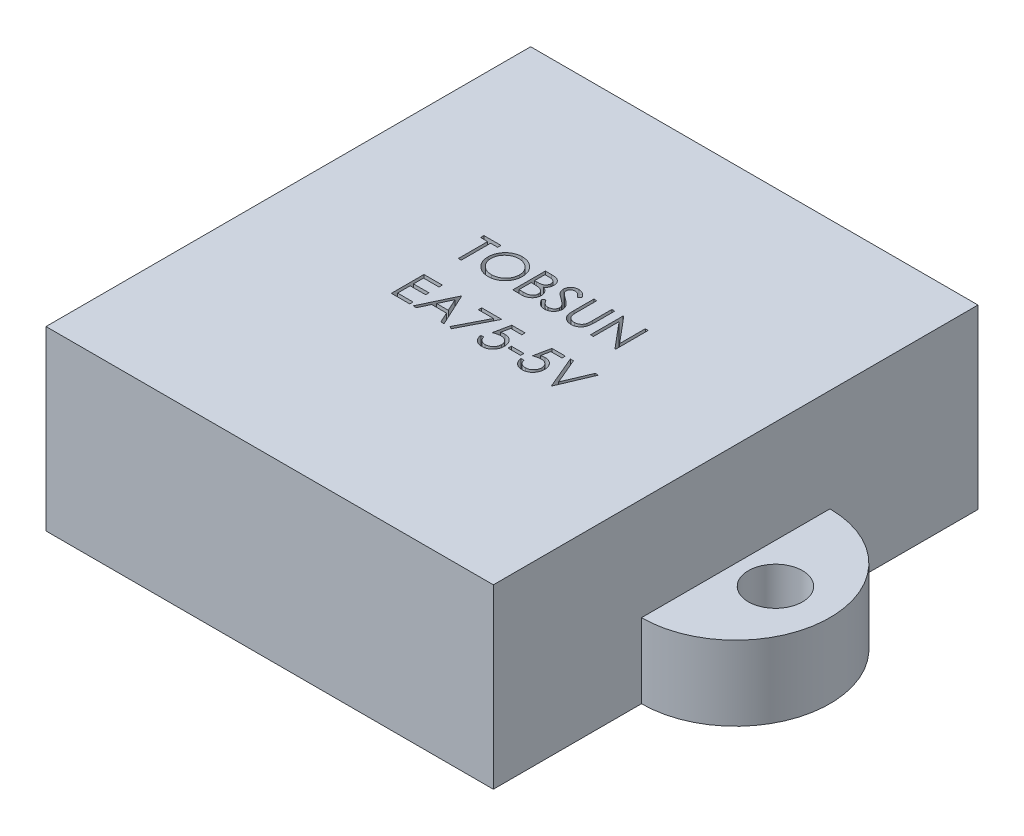
from build123d import *

# Parameters (mm, degrees)
BOSS_EXTRUDE1_DEPTH = 19
SKETCH1_3_R         = 2.903793018
BOSS_EXTRUDE2_DEPTH = 8
SKETCH2_W           = 1.346153847
SKETCH2_H           = 0.358974359
CUT_EXTRUDE1_DEPTH  = 5.08


with BuildPart() as part:
    # Sketch1 → Boss-Extrude1 (new body)
    with BuildSketch(Plane(origin=(0, 0, 0), x_dir=(1, 0, 0), z_dir=(0, 1, 0))):
        Polygon((-24, -10.110797376), (-24, -26), (24, -26), (24, -10.110797376), (24, 10.110797376), (24, 26), (-24, 26), (-24, 10.110797376), align=None)
    extrude(amount=BOSS_EXTRUDE1_DEPTH)

    # Sketch1<3> → Boss-Extrude2 (add)
    # profile 1 of 2: a face of its own
    with BuildSketch(Plane(origin=(0, 0, 0), x_dir=(1, 0, 0), z_dir=(0, 1, 0))):
        with BuildLine():
            ThreePointArc((-24, 10.110797376), (-34.110797376, 0), (-24, -10.110797376))
            Line((-24, -10.110797376), (-24, 10.110797376))
        make_face()
        with Locations((-28.268250103, 0)):
            Circle(SKETCH1_3_R, mode=Mode.SUBTRACT)
    # profile 2 of 2: a face of its own
    with BuildSketch(Plane(origin=(0, 0, 0), x_dir=(1, 0, 0), z_dir=(0, 1, 0))):
        with BuildLine():
            Line((24, 10.110797376), (24, -10.110797376))
            ThreePointArc((24, -10.110797376), (34.110797376, 0), (24, 10.110797376))
        make_face()
        with Locations((28.268250103, 0)):
            Circle(SKETCH1_3_R, mode=Mode.SUBTRACT)
    extrude(amount=BOSS_EXTRUDE2_DEPTH)

    # Sketch2 → Cut-Extrude1 (cut)
    # profile 1 of 13: a face of its own
    with BuildSketch(Plane(origin=(0, 19, 0), x_dir=(1, 0, 0), z_dir=(0, 1, 0))):
        Polygon((-8.963909343, 5.588292958), (-8.963909343, 5.947267317), (-7.124165753, 5.947267317), (-7.124165753, 5.588292958), (-7.886986266, 5.588292958), (-7.886986266, 2.447267317), (-8.20108883, 2.447267317), (-8.20108883, 5.588292958), align=None)
    # profile 2 of 13: a face of its own
    with BuildSketch(Plane(origin=(0, 19, 0), x_dir=(1, 0, 0), z_dir=(0, 1, 0))):
        with BuildLine():
            add(Edge.make_bspline(
                [(-4.947883702, 6.037010907), (-4.883075596, 6.035369427), (-4.755787129, 6.032145426), (-4.568712231, 6.007466323), (-4.390117136, 5.964770933), (-4.218546997, 5.90790795), (-4.056054021, 5.832053565), (-3.901415128, 5.740368417), (-3.754998254, 5.631891958), (-3.618776873, 5.507462731), (-3.494119923, 5.372079277), (-3.384294036, 5.227601367), (-3.292251743, 5.074902565), (-3.216665955, 4.914441734), (-3.157367346, 4.746581766), (-3.116448302, 4.570427763), (-3.090310152, 4.387121073), (-3.087254374, 4.262094209), (-3.085704215, 4.198669561)],
                knots=[0, 0, 0, 0, 1.065120563, 2.091984664, 3.0946048, 4.079830382, 5.057816894, 6.036188127, 7.030412546, 8.04752943, 9.064399622, 10.05169764, 11.02544977, 11.989514704, 12.962713494, 13.945757189, 14.957906945, 16, 16, 16, 16], degree=3))
            add(Edge.make_bspline(
                [(-3.085704215, 4.198669561), (-3.087254147, 4.135712114), (-3.090309244, 4.011615694), (-3.116478021, 3.82947225), (-3.157519021, 3.654381553), (-3.216115288, 3.4866359), (-3.291340766, 3.326058337), (-3.383995937, 3.173071383), (-3.493137148, 3.027624884), (-3.617343999, 2.891312219), (-3.752745041, 2.766314748), (-3.897975308, 2.657395873), (-4.049768628, 2.563671748), (-4.210078336, 2.488888074), (-4.376778373, 2.429116154), (-4.551360696, 2.388363524), (-4.73300725, 2.36207648), (-4.856878254, 2.359057964), (-4.91983883, 2.357523727)],
                knots=[0, 0, 0, 0, 1.043624062, 2.057103931, 3.04512605, 4.022047818, 4.998200453, 5.980619268, 6.982898556, 8.009068085, 9.034988726, 10.034168286, 11.015286542, 11.987931943, 12.962482838, 13.94673481, 14.956375938, 16, 16, 16, 16], degree=3))
            add(Edge.make_bspline(
                [(-4.91983883, 2.357523727), (-4.983263149, 2.359073114), (-5.108289365, 2.362127368), (-5.2918264, 2.388308773), (-5.468104144, 2.429250077), (-5.636618496, 2.487759513), (-5.797463425, 2.563376744), (-5.950953508, 2.655581123), (-6.096472655, 2.764988264), (-6.232814402, 2.889154838), (-6.3575636, 3.02432639), (-6.466322975, 3.169160645), (-6.558548089, 3.320816102), (-6.633911421, 3.479713626), (-6.693575881, 3.645085069), (-6.734280699, 3.818033546), (-6.760616651, 3.997573052), (-6.763651497, 4.119815951), (-6.765191394, 4.181842637)],
                knots=[0, 0, 0, 0, 1.053102029, 2.075944431, 3.073151272, 4.055350789, 5.033113405, 6.020478099, 7.024410459, 8.052272461, 9.079885166, 10.07527673, 11.055994387, 12.023226415, 12.992069828, 13.970394897, 14.97016774, 16, 16, 16, 16], degree=3))
            add(Edge.make_bspline(
                [(-6.765191394, 4.181842637), (-6.764656759, 4.223475307), (-6.763594232, 4.30621543), (-6.75080254, 4.42908203), (-6.732240839, 4.549972688), (-6.705638926, 4.668543636), (-6.670847259, 4.784504621), (-6.629795232, 4.898655384), (-6.579655386, 5.009839107), (-6.522974738, 5.118582499), (-6.45971293, 5.223190405), (-6.389837181, 5.322069988), (-6.315801812, 5.416050985), (-6.234638419, 5.502697989), (-6.149021974, 5.584531645), (-6.057563596, 5.660294362), (-5.960821351, 5.730669313), (-5.858378971, 5.794089654), (-5.752760697, 5.851448789), (-5.643883919, 5.90067064), (-5.533227347, 5.942916701), (-5.420272699, 5.977157526), (-5.305319927, 6.004189562), (-5.188118143, 6.022596916), (-5.068760716, 6.035421234), (-4.988349397, 6.036478736), (-4.947883702, 6.037010907)],
                knots=[0, 0, 0, 0, 1.037015668, 2.060948919, 3.074880161, 4.083647147, 5.086022904, 6.090072063, 7.104153813, 8.122640571, 9.144368836, 10.147691507, 11.138137339, 12.123020368, 13.103399296, 14.087645067, 15.080126199, 16.082011238, 17.087798457, 18.072939717, 19.057185487, 20.037253025, 21.01195951, 21.997135196, 22.992090687, 24, 24, 24, 24], degree=3))
        make_face()
        with BuildLine():
            add(Edge.make_bspline(
                [(-4.932459022, 5.678036548), (-4.965673656, 5.677631657), (-5.031785389, 5.676825748), (-5.130069925, 5.666210032), (-5.227061859, 5.651080143), (-5.322781221, 5.629498622), (-5.416827511, 5.60009457), (-5.510077352, 5.566253661), (-5.601680406, 5.525032571), (-5.691334263, 5.478459867), (-5.778249339, 5.426910946), (-5.86026204, 5.369939179), (-5.937584684, 5.308880624), (-6.010027951, 5.243592787), (-6.077379123, 5.173743185), (-6.140963824, 5.100390749), (-6.198233406, 5.021438858), (-6.250718983, 4.939028451), (-6.297686823, 4.85326687), (-6.339452178, 4.765057008), (-6.373616187, 4.673679321), (-6.401478563, 4.580125163), (-6.424578374, 4.484542704), (-6.439212298, 4.386206855), (-6.449944657, 4.285611743), (-6.450704503, 4.217629889), (-6.45108883, 4.183244881)],
                knots=[0, 0, 0, 0, 1.008559885, 2.007477868, 2.99961109, 3.989939068, 4.984837346, 5.991145699, 7.001802488, 8.033829008, 9.059044045, 10.069351652, 11.065060232, 12.050310815, 13.029377138, 14.011219647, 14.996725999, 15.989392538, 16.977580475, 17.965360261, 18.951710183, 19.937753436, 20.929683414, 21.935841486, 22.955955122, 24, 24, 24, 24], degree=3))
            add(Edge.make_bspline(
                [(-6.45108883, 4.183244881), (-6.449813968, 4.13268266), (-6.44730592, 4.03321113), (-6.42534835, 3.887442986), (-6.391526376, 3.7473547), (-6.341669009, 3.61371279), (-6.279318395, 3.485368508), (-6.202291504, 3.363460403), (-6.111032419, 3.247955529), (-6.007368892, 3.13966026), (-5.894046186, 3.040814455), (-5.773713456, 2.954051047), (-5.647659848, 2.880640797), (-5.515556646, 2.820835725), (-5.378109106, 2.773445987), (-5.234431555, 2.740967356), (-5.085481096, 2.7195919), (-4.983950441, 2.717539144), (-4.932459022, 2.716498086)],
                knots=[0, 0, 0, 0, 1.032063989, 2.030389145, 3.003944642, 3.970395727, 4.937377036, 5.913328081, 6.909231446, 7.93887556, 8.970685674, 9.976071282, 10.964166581, 11.944589148, 12.933237628, 13.927779006, 14.949070134, 16, 16, 16, 16], degree=3))
            add(Edge.make_bspline(
                [(-4.932459022, 2.716498086), (-4.897849521, 2.716973591), (-4.829208484, 2.717916659), (-4.727112962, 2.727415335), (-4.62685675, 2.742647205), (-4.528580471, 2.76457786), (-4.432395659, 2.792025067), (-4.337900856, 2.824632795), (-4.246102566, 2.865313998), (-4.155842728, 2.91026195), (-4.069446486, 2.961502108), (-3.986970954, 3.016540257), (-3.910494974, 3.077508878), (-3.838105903, 3.141826691), (-3.770478214, 3.210790538), (-3.708069229, 3.28431076), (-3.651089097, 3.362851417), (-3.598623451, 3.445136823), (-3.551820188, 3.531133076), (-3.511041089, 3.619662754), (-3.476444973, 3.710507863), (-3.448516468, 3.803799435), (-3.426631007, 3.899360283), (-3.411551087, 3.997318362), (-3.401002648, 4.097477704), (-3.400207571, 4.16522156), (-3.399806779, 4.199370682)],
                knots=[0, 0, 0, 0, 1.047197238, 2.076906641, 3.100256066, 4.114471768, 5.12198147, 6.126382909, 7.136867548, 8.15857795, 9.17633901, 10.174870724, 11.156907918, 12.133735059, 13.104061851, 14.077631395, 15.04955518, 16.038496417, 17.029181396, 18.010275684, 18.986308667, 19.968651475, 20.955262928, 21.950658345, 22.966943676, 24, 24, 24, 24], degree=3))
            add(Edge.make_bspline(
                [(-3.399806779, 4.199370682), (-3.400207892, 4.233286187), (-3.401003573, 4.300563837), (-3.411546048, 4.400024655), (-3.426646938, 4.497277867), (-3.448409646, 4.59194167), (-3.4764598, 4.684040195), (-3.511047131, 4.773486942), (-3.55183243, 4.860615137), (-3.598640654, 4.945209434), (-3.651256478, 5.026384172), (-3.708750721, 5.103986585), (-3.772116069, 5.176559326), (-3.839542094, 5.24589402), (-3.912712979, 5.31051191), (-3.991297274, 5.370434431), (-4.074340951, 5.427107705), (-4.162268187, 5.478233267), (-4.253012141, 5.525447499), (-4.346126098, 5.565898503), (-4.440555198, 5.600270622), (-4.53605931, 5.629587587), (-4.633442289, 5.650995617), (-4.732046118, 5.666223667), (-4.831734376, 5.676822053), (-4.898777596, 5.677630431), (-4.932459022, 5.678036548)],
                knots=[0, 0, 0, 0, 1.02996197, 2.043119294, 3.035359645, 4.018872909, 4.991431989, 5.957985074, 6.929999688, 7.912076566, 8.892894881, 9.867085534, 10.843653904, 11.817741046, 12.803660682, 13.806313499, 14.818574707, 15.856120519, 16.894564902, 17.924820532, 18.937903209, 19.946497019, 20.957711757, 21.963978472, 22.977135795, 24, 24, 24, 24], degree=3))
        make_face(mode=Mode.SUBTRACT)
    # profile 3 of 13: a face of its own
    with BuildSketch(Plane(origin=(0, 19, 0), x_dir=(1, 0, 0), z_dir=(0, 1, 0))):
        with BuildLine():
            Line((-2.367755497, 5.947267317), (-1.684862869, 5.947267317))
            add(Edge.make_bspline(
                [(-1.684862869, 5.947267317), (-1.65143439, 5.947091567), (-1.58664168, 5.946750919), (-1.492422238, 5.941467787), (-1.404173428, 5.934264118), (-1.321869655, 5.922834025), (-1.245548953, 5.909042248), (-1.174981316, 5.892340432), (-1.110391143, 5.872313818), (-1.033278407, 5.840467537), (-0.945357746, 5.793144368), (-0.850159353, 5.723215803), (-0.768755114, 5.63768334), (-0.698568797, 5.541200685), (-0.642767677, 5.435064913), (-0.60239838, 5.321805724), (-0.576840505, 5.202883982), (-0.57421207, 5.121240804), (-0.572883702, 5.079979657)],
                knots=[0, 0, 0, 0, 1.001505555, 1.941167018, 2.826882275, 3.653841531, 4.429895133, 5.150066043, 5.825578002, 6.45369114, 7.647487171, 8.808567382, 9.977351308, 11.170798116, 12.373658725, 13.556498008, 14.765093433, 16, 16, 16, 16], degree=3))
            add(Edge.make_bspline(
                [(-0.572883702, 5.079979657), (-0.57397692, 5.041327101), (-0.576125198, 4.965371184), (-0.596667957, 4.854277075), (-0.628828626, 4.748525856), (-0.673533875, 4.64850347), (-0.731635871, 4.556469857), (-0.80049419, 4.471682591), (-0.883570992, 4.397731534), (-0.945814232, 4.356388632), (-0.977430978, 4.335388311)],
                knots=[0, 0, 0, 0, 1.044552857, 2.05264487, 3.044412934, 4.028983338, 5.005914585, 5.980388656, 6.974128949, 8, 8, 8, 8], degree=3))
            add(Edge.make_bspline(
                [(-0.977430978, 4.335388311), (-0.93767055, 4.320123312), (-0.861599003, 4.290917587), (-0.75691299, 4.239282123), (-0.666718145, 4.183120013), (-0.590320999, 4.121788163), (-0.524983344, 4.055679352), (-0.467930403, 3.983824238), (-0.419249029, 3.90528548), (-0.377536105, 3.820881944), (-0.344987349, 3.731475476), (-0.320611445, 3.6379047), (-0.306643995, 3.540505145), (-0.304656354, 3.474219765), (-0.303652933, 3.4407569)],
                knots=[0, 0, 0, 0, 1.27268992, 2.434971085, 3.483601985, 4.442670788, 5.356604649, 6.2567628, 7.179492994, 8.113709626, 9.066344395, 10.018646069, 10.999752585, 12, 12, 12, 12], degree=3))
            add(Edge.make_bspline(
                [(-0.303652933, 3.4407569), (-0.304629779, 3.406590028), (-0.306551751, 3.33936575), (-0.320731722, 3.240610616), (-0.344740829, 3.146235669), (-0.377811976, 3.055630486), (-0.42097429, 2.968970352), (-0.473502255, 2.886157088), (-0.536133818, 2.808022757), (-0.606196687, 2.733699134), (-0.685458833, 2.666871347), (-0.770974588, 2.60735564), (-0.863820908, 2.558409578), (-0.962472902, 2.517293556), (-1.068037218, 2.485886358), (-1.180039825, 2.463913784), (-1.298384127, 2.449108747), (-1.379593878, 2.447891542), (-1.421241074, 2.447267317)],
                knots=[0, 0, 0, 0, 0.978564426, 1.925352924, 2.850884081, 3.763762016, 4.682927383, 5.618979971, 6.567305752, 7.547517671, 8.540179244, 9.531824382, 10.526200242, 11.540722885, 12.589160233, 13.674978461, 14.80764778, 16, 16, 16, 16], degree=3))
            Line((-1.421241074, 2.447267317), (-2.367755497, 2.447267317))
            Line((-2.367755497, 2.447267317), (-2.367755497, 5.947267317))
        make_face()
        with BuildLine():
            Line((-2.053652933, 5.588292958), (-2.053652933, 4.466498086))
            Line((-2.053652933, 4.466498086), (-1.842615272, 4.466498086))
            add(Edge.make_bspline(
                [(-1.842615272, 4.466498086), (-1.811766477, 4.466898009), (-1.752160318, 4.467670742), (-1.665840421, 4.469884259), (-1.585715403, 4.476082302), (-1.51192357, 4.482278564), (-1.444581126, 4.492353152), (-1.383837265, 4.504345275), (-1.328738668, 4.51702818), (-1.265199122, 4.538597667), (-1.193126174, 4.570475342), (-1.116293069, 4.619947178), (-1.0485586, 4.678871532), (-0.991361412, 4.746862493), (-0.944549942, 4.821728679), (-0.912036226, 4.90227556), (-0.889988942, 4.986495692), (-0.887997411, 5.044313944), (-0.886986266, 5.073669561)],
                knots=[0, 0, 0, 0, 1.156816544, 2.235205308, 3.236616184, 4.169592532, 5.011045266, 5.787822928, 6.49130361, 7.128639758, 8.301311294, 9.436451833, 10.541879658, 11.654887649, 12.756523258, 13.837046038, 14.901820046, 16, 16, 16, 16], degree=3))
            add(Edge.make_bspline(
                [(-0.886986266, 5.073669561), (-0.887512446, 5.093095332), (-0.888544606, 5.131201104), (-0.896997909, 5.186750458), (-0.911365483, 5.238994211), (-0.929819776, 5.288648321), (-0.955608465, 5.334160171), (-0.985971928, 5.377103367), (-1.022657619, 5.416015486), (-1.064414931, 5.452384984), (-1.112423554, 5.484629512), (-1.166654846, 5.512870275), (-1.227842523, 5.535611052), (-1.294955378, 5.555527204), (-1.369026466, 5.569515498), (-1.449201019, 5.581168886), (-1.536135738, 5.587101628), (-1.596280841, 5.58788699), (-1.627370881, 5.588292958)],
                knots=[0, 0, 0, 0, 0.91205012, 1.789085906, 2.630437955, 3.453916878, 4.269457761, 5.079663411, 5.91843418, 6.774407191, 7.675494373, 8.627863946, 9.638891023, 10.736472738, 11.911756761, 13.175263542, 14.539845004, 16, 16, 16, 16], degree=3))
            Line((-1.627370881, 5.588292958), (-2.053652933, 5.588292958))
        make_face(mode=Mode.SUBTRACT)
        with BuildLine():
            Line((-2.053652933, 4.107523727), (-2.053652933, 2.806241676))
            Line((-2.053652933, 2.806241676), (-1.606337228, 2.806241676))
            add(Edge.make_bspline(
                [(-1.606337228, 2.806241676), (-1.574318302, 2.806625423), (-1.512606043, 2.807365046), (-1.423504813, 2.8097796), (-1.340921709, 2.815271876), (-1.265233573, 2.823917726), (-1.195623121, 2.833296175), (-1.132925418, 2.845907456), (-1.076632224, 2.860356416), (-1.011357917, 2.882690589), (-0.937854408, 2.91738706), (-0.858643552, 2.969701286), (-0.788217334, 3.032024594), (-0.728412075, 3.104155508), (-0.679399086, 3.182586835), (-0.643743631, 3.265732185), (-0.621752774, 3.352217712), (-0.619090605, 3.411184425), (-0.617755497, 3.4407569)],
                knots=[0, 0, 0, 0, 1.160039823, 2.235823828, 3.228722157, 4.157150951, 4.99529583, 5.772374946, 6.472645482, 7.099169577, 8.269452708, 9.405989375, 10.527446681, 11.663510218, 12.788923519, 13.866172445, 14.929861265, 16, 16, 16, 16], degree=3))
            add(Edge.make_bspline(
                [(-0.617755497, 3.4407569), (-0.618031601, 3.459250241), (-0.618579356, 3.495938623), (-0.626839971, 3.549854442), (-0.638853841, 3.602080315), (-0.654385275, 3.652758056), (-0.677004742, 3.700971432), (-0.703411287, 3.747673991), (-0.734372689, 3.792927471), (-0.782616854, 3.850139724), (-0.852788839, 3.916056737), (-0.952495614, 3.98059424), (-1.065867912, 4.032642047), (-1.148095405, 4.054741523), (-1.190572003, 4.066157541)],
                knots=[0, 0, 0, 0, 0.723448775, 1.435228256, 2.130040452, 2.821711965, 3.505591119, 4.210454504, 4.921174351, 5.648778258, 7.137944449, 8.670945889, 10.280296675, 12, 12, 12, 12], degree=3))
            add(Edge.make_bspline(
                [(-1.190572003, 4.066157541), (-1.207601099, 4.069612625), (-1.244523691, 4.07710396), (-1.304731272, 4.085011663), (-1.373467141, 4.092056723), (-1.450890018, 4.097267881), (-1.537097859, 4.102654424), (-1.632274778, 4.104749246), (-1.736032092, 4.107248506), (-1.808024465, 4.10742964), (-1.84541976, 4.107523727)],
                knots=[0, 0, 0, 0, 0.634451884, 1.375622551, 2.216452059, 3.157844607, 4.20941857, 5.370758133, 6.634282058, 8, 8, 8, 8], degree=3))
            Line((-1.84541976, 4.107523727), (-2.053652933, 4.107523727))
        make_face(mode=Mode.SUBTRACT)
    # profile 4 of 13: a face of its own
    with BuildSketch(Plane(origin=(0, 19, 0), x_dir=(1, 0, 0), z_dir=(0, 1, 0))):
        with BuildLine():
            Line((0.055321426, 3.122447605), (0.351194824, 3.29983142))
            add(Edge.make_bspline(
                [(0.351194824, 3.29983142), (0.378713061, 3.253767035), (0.431436942, 3.165509451), (0.519388301, 3.04625141), (0.610521212, 2.944889254), (0.705510545, 2.862012646), (0.803776494, 2.796763759), (0.905960547, 2.750561527), (1.011718358, 2.721745552), (1.083692179, 2.718245466), (1.119624311, 2.716498086)],
                knots=[0, 0, 0, 0, 1.272034388, 2.437168799, 3.508375237, 4.49857839, 5.41946034, 6.295179144, 7.148887113, 8, 8, 8, 8], degree=3))
            add(Edge.make_bspline(
                [(1.119624311, 2.716498086), (1.150311171, 2.717352759), (1.211147944, 2.719047149), (1.300710187, 2.735327951), (1.38769199, 2.76034008), (1.470300627, 2.796161011), (1.547396242, 2.839499497), (1.615002937, 2.891845675), (1.67344905, 2.95045188), (1.721258165, 3.015834535), (1.7579382, 3.086151684), (1.786130269, 3.158327635), (1.801775342, 3.233496203), (1.804132096, 3.284106666), (1.805321426, 3.309647125)],
                knots=[0, 0, 0, 0, 1.095163259, 2.171163733, 3.241058638, 4.321873601, 5.38011039, 6.391990106, 7.366004449, 8.327778327, 9.272591725, 10.192022065, 11.087607919, 12, 12, 12, 12], degree=3))
            add(Edge.make_bspline(
                [(1.805321426, 3.309647125), (1.803847116, 3.338787974), (1.800850057, 3.398027064), (1.775518577, 3.485426716), (1.73566933, 3.571919287), (1.698906687, 3.625420552), (1.679820625, 3.653196804)],
                knots=[0, 0, 0, 0, 0.938893495, 1.908633276, 2.914225137, 4, 4, 4, 4], degree=3))
            add(Edge.make_bspline(
                [(1.679820625, 3.653196804), (1.664150011, 3.673243628), (1.631251516, 3.715329426), (1.574694004, 3.777974662), (1.50832789, 3.842593081), (1.434424335, 3.911652138), (1.350291246, 3.981939934), (1.258563731, 4.056808212), (1.156899872, 4.133409789), (1.085600376, 4.184782355), (1.04881101, 4.211289753)],
                knots=[0, 0, 0, 0, 0.722233717, 1.516239348, 2.393582979, 3.351407094, 4.387010283, 5.505090956, 6.712668013, 8, 8, 8, 8], degree=3))
            add(Edge.make_bspline(
                [(1.04881101, 4.211289753), (1.011987013, 4.23751834), (0.941582337, 4.287665403), (0.843123754, 4.362089687), (0.755079291, 4.430133556), (0.677840275, 4.492437568), (0.611440678, 4.549010173), (0.555357267, 4.599308112), (0.51101871, 4.644691673), (0.486363129, 4.674133015), (0.475293381, 4.687351452)],
                knots=[0, 0, 0, 0, 1.452282411, 2.77665338, 3.964542531, 5.026858415, 5.96415736, 6.766646006, 7.446254459, 8, 8, 8, 8], degree=3))
            add(Edge.make_bspline(
                [(0.475293381, 4.687351452), (0.459820836, 4.707952488), (0.429391999, 4.748467192), (0.389225994, 4.81179205), (0.355086831, 4.876615315), (0.328324499, 4.94311118), (0.30578828, 5.010346109), (0.290630349, 5.079197355), (0.281138953, 5.149355973), (0.280166966, 5.196569474), (0.279680401, 5.220204016)],
                knots=[0, 0, 0, 0, 1.068054152, 2.10047183, 3.106115577, 4.101338837, 5.06977816, 6.043150881, 7.020423561, 8, 8, 8, 8], degree=3))
            add(Edge.make_bspline(
                [(0.279680401, 5.220204016), (0.28098561, 5.25723379), (0.28356813, 5.330501854), (0.305408647, 5.437532684), (0.339881541, 5.539719102), (0.388176428, 5.636049435), (0.450433781, 5.724015416), (0.522479756, 5.804628903), (0.608291242, 5.872397485), (0.702443865, 5.931609544), (0.805500237, 5.977955469), (0.913491141, 6.012916449), (1.026588213, 6.032725707), (1.103191347, 6.035568472), (1.142060208, 6.037010907)],
                knots=[0, 0, 0, 0, 1.005424448, 1.989358655, 2.955360095, 3.929531133, 4.905563448, 5.876582895, 6.856512386, 7.866279853, 8.892233794, 9.918561126, 10.94386622, 12, 12, 12, 12], degree=3))
            add(Edge.make_bspline(
                [(1.142060208, 6.037010907), (1.183304309, 6.035588355), (1.26532566, 6.032759354), (1.385974876, 6.008161823), (1.502135592, 5.967461151), (1.595578857, 5.921272493), (1.668711619, 5.875141077), (1.724484351, 5.833121253), (1.781001802, 5.784746144), (1.838719857, 5.729886898), (1.896660516, 5.668040147), (1.955683969, 5.599629458), (2.015928237, 5.525072902), (2.054684098, 5.471848402), (2.074552195, 5.44456299)],
                knots=[0, 0, 0, 0, 1.286793592, 2.559021753, 3.825965368, 5.121522368, 5.803751409, 6.523245864, 7.299691795, 8.125521123, 9.008227632, 9.944561021, 10.946284179, 12, 12, 12, 12], degree=3))
            Line((2.074552195, 5.44456299), (1.790597869, 5.229318599))
            add(Edge.make_bspline(
                [(1.790597869, 5.229318599), (1.773451936, 5.251407289), (1.740432879, 5.293944943), (1.690303392, 5.353516258), (1.643054744, 5.407932738), (1.596504344, 5.455197866), (1.553110713, 5.497899999), (1.510993671, 5.534459756), (1.470759319, 5.565235351), (1.420042409, 5.598078911), (1.356324691, 5.630635415), (1.276340154, 5.658184493), (1.192753879, 5.674739555), (1.135824248, 5.676928443), (1.107004119, 5.678036548)],
                knots=[0, 0, 0, 0, 1.181633172, 2.275549214, 3.290209073, 4.226197932, 5.078386478, 5.862611352, 6.581680152, 7.217281963, 8.414376989, 9.595101626, 10.782541182, 12, 12, 12, 12], degree=3))
            add(Edge.make_bspline(
                [(1.107004119, 5.678036548), (1.070847596, 5.676824848), (1.001123149, 5.674488199), (0.902132913, 5.648968213), (0.813038988, 5.608786353), (0.736486422, 5.552471375), (0.672749445, 5.485750382), (0.626643987, 5.408971527), (0.598893822, 5.324189125), (0.595507542, 5.265047468), (0.593782965, 5.234927573)],
                knots=[0, 0, 0, 0, 1.14458467, 2.207223713, 3.21896685, 4.227309161, 5.202851033, 6.127160689, 7.046193047, 8, 8, 8, 8], degree=3))
            add(Edge.make_bspline(
                [(0.593782965, 5.234927573), (0.594176091, 5.216176095), (0.594962987, 5.178642475), (0.605937785, 5.123191053), (0.620037114, 5.067879714), (0.642379746, 5.012957131), (0.673225049, 4.957462772), (0.713730225, 4.900441035), (0.764743537, 4.841389326), (0.80382055, 4.802981952), (0.824452035, 4.782704016)],
                knots=[0, 0, 0, 0, 0.858281714, 1.717966888, 2.583508476, 3.4729293, 4.427298488, 5.488583878, 6.674047936, 8, 8, 8, 8], degree=3))
            add(Edge.make_bspline(
                [(0.824452035, 4.782704016), (0.832113408, 4.77586699), (0.850315075, 4.759623782), (0.883591, 4.733031501), (0.927533799, 4.700228729), (0.980996, 4.659641412), (1.044963362, 4.61255995), (1.119442918, 4.559586338), (1.203604451, 4.499000879), (1.263326367, 4.456643338), (1.29490476, 4.434246484)],
                knots=[0, 0, 0, 0, 0.420754252, 0.999615792, 1.744751191, 2.668019286, 3.750313428, 4.999500688, 6.413464383, 8, 8, 8, 8], degree=3))
            add(Edge.make_bspline(
                [(1.29490476, 4.434246484), (1.332890673, 4.406605124), (1.406445129, 4.353081462), (1.511102709, 4.272665782), (1.605996517, 4.194018014), (1.691459721, 4.117640407), (1.768336629, 4.044112314), (1.83577435, 3.972549133), (1.89446003, 3.903463561), (1.957639249, 3.814890985), (2.022197068, 3.706109901), (2.077638576, 3.572831662), (2.112596923, 3.439035342), (2.117168439, 3.349108505), (2.11942399, 3.304739272)],
                knots=[0, 0, 0, 0, 1.163667725, 2.253281268, 3.268753668, 4.215851969, 5.092017293, 5.902905408, 6.650798638, 7.335211899, 8.59617414, 9.77448103, 10.901945474, 12, 12, 12, 12], degree=3))
            add(Edge.make_bspline(
                [(2.11942399, 3.304739272), (2.118766852, 3.273360907), (2.117465337, 3.211213523), (2.102504423, 3.119958447), (2.080584758, 3.031327577), (2.047547524, 2.946416464), (2.007224366, 2.863671702), (1.956058118, 2.785263801), (1.896750433, 2.709457403), (1.828716668, 2.638273911), (1.754270766, 2.572927715), (1.675587072, 2.514798654), (1.592536799, 2.466330331), (1.505570482, 2.426779489), (1.414668145, 2.395845971), (1.319860361, 2.373433102), (1.22099085, 2.359677391), (1.153790369, 2.358249629), (1.119624311, 2.357523727)],
                knots=[0, 0, 0, 0, 0.983748083, 1.948392443, 2.894712957, 3.844097841, 4.80183111, 5.778335162, 6.776009319, 7.81870978, 8.863265674, 9.881300176, 10.883814829, 11.87499822, 12.874611388, 13.892143829, 14.928324115, 16, 16, 16, 16], degree=3))
            add(Edge.make_bspline(
                [(1.119624311, 2.357523727), (1.093188968, 2.358034909), (1.040651208, 2.359050834), (0.962941726, 2.368032115), (0.886802137, 2.380739218), (0.813187855, 2.400913288), (0.741150443, 2.425390265), (0.671003209, 2.455528598), (0.602712155, 2.491645799), (0.535894572, 2.532940824), (0.470720397, 2.580998568), (0.407800929, 2.636972065), (0.345071744, 2.69931757), (0.284384347, 2.769728133), (0.224511203, 2.847066216), (0.166632794, 2.9320554), (0.109551076, 3.024232753), (0.073735608, 3.089097839), (0.055321426, 3.122447605)],
                knots=[0, 0, 0, 0, 0.915332311, 1.819136955, 2.706846663, 3.586547465, 4.459518054, 5.340707479, 6.227863349, 7.133153174, 8.059268498, 9.028702269, 10.047606654, 11.120612155, 12.245963614, 13.433783089, 14.680604001, 16, 16, 16, 16], degree=3))
        make_face()
    # profile 5 of 13: a face of its own
    with BuildSketch(Plane(origin=(0, 19, 0), x_dir=(1, 0, 0), z_dir=(0, 1, 0))):
        with BuildLine():
            Line((2.837372708, 5.947267317), (3.151475272, 5.947267317))
            Line((3.151475272, 5.947267317), (3.151475272, 3.850212029))
            add(Edge.make_bspline(
                [(3.151475272, 3.850212029), (3.151428528, 3.820531293), (3.151339824, 3.764206982), (3.151932338, 3.684038681), (3.153591706, 3.612766222), (3.154637866, 3.550114875), (3.156965199, 3.496372127), (3.158863246, 3.451246817), (3.161303803, 3.414952614), (3.16423692, 3.393771688), (3.165497708, 3.384667157)],
                knots=[0, 0, 0, 0, 1.528628734, 2.90083645, 4.128790002, 5.200304208, 6.127813768, 6.898992206, 7.526736466, 8, 8, 8, 8], degree=3))
            add(Edge.make_bspline(
                [(3.165497708, 3.384667157), (3.170675167, 3.351820393), (3.180738353, 3.287977664), (3.206384731, 3.197069382), (3.242202232, 3.115137924), (3.284645275, 3.039626633), (3.340577886, 2.972637273), (3.407581422, 2.91092562), (3.48875919, 2.856953816), (3.579019796, 2.807603004), (3.676305033, 2.767937921), (3.7757163, 2.737944557), (3.875759279, 2.719665657), (3.942735444, 2.717549118), (3.975994503, 2.716498086)],
                knots=[0, 0, 0, 0, 1.035780045, 2.013197591, 2.933192213, 3.817615948, 4.702609284, 5.640816605, 6.646850145, 7.73207398, 8.84249596, 9.914020372, 10.964143139, 12, 12, 12, 12], degree=3))
            add(Edge.make_bspline(
                [(3.975994503, 2.716498086), (4.004548244, 2.717571936), (4.061490805, 2.719713435), (4.146097236, 2.732974866), (4.228497345, 2.756875431), (4.309098025, 2.78771519), (4.384649009, 2.828462781), (4.455192451, 2.87553362), (4.518156385, 2.930744496), (4.575614383, 2.991844841), (4.625649319, 3.060784641), (4.669020461, 3.136062779), (4.70454639, 3.218812126), (4.722089915, 3.276966548), (4.731102676, 3.306842637)],
                knots=[0, 0, 0, 0, 0.994687771, 1.983630487, 2.973142513, 3.978332533, 4.983357753, 5.956394766, 6.925816176, 7.893390482, 8.871859704, 9.88551698, 10.913711441, 12, 12, 12, 12], degree=3))
            add(Edge.make_bspline(
                [(4.731102676, 3.306842637), (4.734102802, 3.319191212), (4.74078829, 3.346708812), (4.747035335, 3.393230102), (4.75354186, 3.448119466), (4.75805643, 3.511771279), (4.762457651, 3.583972252), (4.765090723, 3.665098509), (4.766307756, 3.75485547), (4.766670437, 3.817492632), (4.766859888, 3.850212029)],
                knots=[0, 0, 0, 0, 0.558680831, 1.244966039, 2.062412453, 2.990489873, 4.051219941, 5.244515665, 6.560634259, 8, 8, 8, 8], degree=3))
            Line((4.766859888, 3.850212029), (4.766859888, 5.947267317))
            Line((4.766859888, 5.947267317), (5.080962452, 5.947267317))
            Line((5.080962452, 5.947267317), (5.080962452, 3.833385105))
            add(Edge.make_bspline(
                [(5.080962452, 3.833385105), (5.080708331, 3.795286726), (5.0802124, 3.720935424), (5.075911824, 3.611984065), (5.069054824, 3.508631083), (5.059366736, 3.410862587), (5.046529733, 3.319028427), (5.032254512, 3.232323659), (5.014074979, 3.151370667), (4.992841578, 3.075538249), (4.96856803, 3.003352736), (4.937126881, 2.934844121), (4.901702382, 2.867929721), (4.859687729, 2.803621612), (4.812476346, 2.741635059), (4.759024665, 2.682345984), (4.701100504, 2.624806938), (4.637740945, 2.570493872), (4.56999042, 2.520685195), (4.498050462, 2.476887424), (4.422473692, 2.439863806), (4.343456566, 2.409387882), (4.260965363, 2.386473283), (4.174998003, 2.369398127), (4.08535881, 2.359695829), (4.024394154, 2.358253899), (3.993522548, 2.357523727)],
                knots=[0, 0, 0, 0, 1.316592851, 2.569410997, 3.76748051, 4.895814652, 5.963796859, 6.97159953, 7.931736103, 8.829262218, 9.692595152, 10.560224239, 11.431080259, 12.30701507, 13.211635791, 14.121146779, 15.063487852, 16.031507147, 17.00238618, 17.966455255, 18.938106653, 19.907068911, 20.888905087, 21.893141452, 22.933117798, 24, 24, 24, 24], degree=3))
            add(Edge.make_bspline(
                [(3.993522548, 2.357523727), (3.959853445, 2.358308493), (3.893794787, 2.359848199), (3.796456719, 2.368670949), (3.703142523, 2.385289344), (3.612866646, 2.406449287), (3.526858149, 2.435633025), (3.443964704, 2.469731149), (3.365606023, 2.51160841), (3.290510895, 2.558201803), (3.220686139, 2.610626441), (3.156588735, 2.667766615), (3.098112865, 2.728706992), (3.046244168, 2.794107358), (3.000123284, 2.863459065), (2.96039307, 2.936958305), (2.926279826, 3.014576621), (2.908673259, 3.068529821), (2.899772548, 3.095804977)],
                knots=[0, 0, 0, 0, 1.13879206, 2.234305948, 3.301075583, 4.341971843, 5.366689343, 6.369221514, 7.369726634, 8.367512178, 9.355451585, 10.318319045, 11.268648973, 12.207971039, 13.137398894, 14.081662264, 15.030215811, 16, 16, 16, 16], degree=3))
            add(Edge.make_bspline(
                [(2.899772548, 3.095804977), (2.89459539, 3.114437552), (2.883366018, 3.154852021), (2.871340721, 3.221738509), (2.861231639, 3.298753427), (2.851726081, 3.385902045), (2.846117123, 3.483251912), (2.841199684, 3.590760828), (2.837338066, 3.708558789), (2.837360838, 3.790613305), (2.837372708, 3.833385105)],
                knots=[0, 0, 0, 0, 0.625038921, 1.35572334, 2.194682327, 3.136881307, 4.189498639, 5.346923369, 6.617055217, 8, 8, 8, 8], degree=3))
            Line((2.837372708, 3.833385105), (2.837372708, 5.947267317))
        make_face()
    # profile 6 of 13: a face of its own
    with BuildSketch(Plane(origin=(0, 19, 0), x_dir=(1, 0, 0), z_dir=(0, 1, 0))):
        Polygon((5.978398349, 2.447267317), (5.978398349, 5.947267317), (6.044303798, 5.947267317), (8.356603478, 3.192559785), (8.356603478, 5.947267317), (8.670706042, 5.947267317), (8.670706042, 2.447267317), (8.599191619, 2.447267317), (6.292500913, 5.195664753), (6.292500913, 2.447267317), align=None)
    # profile 7 of 13: a face of its own
    with BuildSketch(Plane(origin=(0, 19, 0), x_dir=(1, 0, 0), z_dir=(0, 1, 0))):
        Polygon((-8.560063189, -0.886066016), (-6.585704215, -0.886066016), (-6.585704215, -1.245040375), (-8.245960625, -1.245040375), (-8.245960625, -2.321963452), (-6.585704215, -2.321963452), (-6.585704215, -2.680937811), (-8.245960625, -2.680937811), (-8.245960625, -4.027091657), (-6.585704215, -4.027091657), (-6.585704215, -4.386066016), (-8.560063189, -4.386066016), align=None)
    # profile 8 of 13: a face of its own
    with BuildSketch(Plane(origin=(0, 19, 0), x_dir=(1, 0, 0), z_dir=(0, 1, 0))):
        Polygon((-4.521601651, -0.886066016), (-2.906217035, -4.386066016), (-3.247663349, -4.386066016), (-3.765091234, -3.264271145), (-5.351729856, -3.264271145), (-5.883881298, -4.386066016), (-6.226729856, -4.386066016), (-4.566473446, -0.886066016), align=None)
        Polygon((-4.547543157, -1.568257523), (-5.18135726, -2.905296786), (-3.930555978, -2.905296786), align=None, mode=Mode.SUBTRACT)
    # profile 9 of 13: a face of its own
    with BuildSketch(Plane(origin=(0, 19, 0), x_dir=(1, 0, 0), z_dir=(0, 1, 0))):
        Polygon((-2.367755497, -0.886066016), (-0.213909343, -0.886066016), (-2.053652933, -4.475809606), (-2.324987067, -4.326470664), (-0.745359664, -1.245040375), (-2.367755497, -1.245040375), align=None)
    # profile 10 of 13: a face of its own
    with BuildSketch(Plane(origin=(0, 19, 0), x_dir=(1, 0, 0), z_dir=(0, 1, 0))):
        with BuildLine():
            Line((2.29891117, -0.886066016), (2.29891117, -1.245040375))
            Line((2.29891117, -1.245040375), (1.108406362, -1.245040375))
            Line((1.108406362, -1.245040375), (0.919804599, -2.165613292))
            add(Edge.make_bspline(
                [(0.919804599, -2.165613292), (0.956860474, -2.15538302), (1.02865037, -2.135563487), (1.13461023, -2.113557716), (1.235202434, -2.100292272), (1.300477804, -2.098480962), (1.332064215, -2.097604478)],
                knots=[0, 0, 0, 0, 1.100273476, 2.13160584, 3.095893838, 4, 4, 4, 4], degree=3))
            add(Edge.make_bspline(
                [(1.332064215, -2.097604478), (1.371147954, -2.098450414), (1.447996352, -2.100113735), (1.560435299, -2.116085584), (1.667768192, -2.141225499), (1.769770562, -2.17634602), (1.866631113, -2.221255754), (1.957458674, -2.277355694), (2.043616587, -2.342889025), (2.123559181, -2.418234037), (2.196083489, -2.501155654), (2.259849479, -2.590313525), (2.314012069, -2.684841187), (2.357572824, -2.785641796), (2.392357158, -2.891600949), (2.415509153, -3.003833532), (2.430925862, -3.121281652), (2.432648249, -3.201586222), (2.433526554, -3.242536369)],
                knots=[0, 0, 0, 0, 1.052922333, 2.070308379, 3.05430497, 4.020497103, 4.973039431, 5.925935799, 6.892292201, 7.88610001, 8.88166317, 9.857072816, 10.836096531, 11.812156883, 12.81219415, 13.836441305, 14.89672472, 16, 16, 16, 16], degree=3))
            add(Edge.make_bspline(
                [(2.433526554, -3.242536369), (2.432861479, -3.271058589), (2.431540317, -3.327717577), (2.424821729, -3.411861778), (2.411886013, -3.494224611), (2.394518289, -3.574817002), (2.371975871, -3.653486375), (2.344686817, -3.730457903), (2.311290789, -3.805252509), (2.274659414, -3.878577904), (2.233412936, -3.948776412), (2.187634429, -4.014425398), (2.139268937, -4.07650968), (2.087227552, -4.134363413), (2.031026557, -4.18760643), (1.97134659, -4.236554712), (1.908663871, -4.282036042), (1.842008629, -4.322204237), (1.772866146, -4.359167194), (1.700237929, -4.389490731), (1.625777228, -4.416601259), (1.548412353, -4.438210787), (1.46831854, -4.455143341), (1.385363764, -4.466643942), (1.299983094, -4.475020379), (1.242108082, -4.475544736), (1.21287351, -4.475809606)],
                knots=[0, 0, 0, 0, 1.056347294, 2.098418968, 3.122841568, 4.141288669, 5.149314143, 6.15115421, 7.162517403, 8.180376062, 9.185164535, 10.17417709, 11.141909838, 12.097768115, 13.052685741, 14.0056014, 14.954263652, 15.917497458, 16.885230207, 17.854509472, 18.828990115, 19.81800267, 20.826176721, 21.857883937, 22.917946725, 24, 24, 24, 24], degree=3))
            add(Edge.make_bspline(
                [(1.21287351, -4.475809606), (1.177999329, -4.475118768), (1.109388498, -4.473759626), (1.008867931, -4.459541141), (0.912153325, -4.439177224), (0.820023224, -4.408540954), (0.731651961, -4.37015366), (0.648229243, -4.321637488), (0.567623467, -4.266658385), (0.49311143, -4.201778032), (0.423955316, -4.13086235), (0.362048808, -4.053904708), (0.306915231, -3.972175266), (0.259437484, -3.885277112), (0.218939463, -3.793438581), (0.187124474, -3.69631558), (0.161446119, -3.594415576), (0.150582699, -3.524262066), (0.145065016, -3.488630119)],
                knots=[0, 0, 0, 0, 1.0467383, 2.05933395, 3.04377827, 4.011590433, 4.970194871, 5.932262533, 6.905835911, 7.896367577, 8.894135286, 9.877477877, 10.858688626, 11.851381753, 12.8477658, 13.868841284, 14.917554742, 16, 16, 16, 16], degree=3))
            Line((0.145065016, -3.488630119), (0.45916758, -3.488630119))
            add(Edge.make_bspline(
                [(0.45916758, -3.488630119), (0.466896137, -3.522006571), (0.481750854, -3.586157966), (0.514356603, -3.676289308), (0.554222478, -3.756608531), (0.601626827, -3.828178115), (0.658176857, -3.890587112), (0.722706286, -3.946204174), (0.795054009, -3.996379303), (0.875447239, -4.03820207), (0.960260318, -4.073870824), (1.049027528, -4.097622519), (1.139331874, -4.114323411), (1.200410245, -4.115995172), (1.231102676, -4.116835247)],
                knots=[0, 0, 0, 0, 1.136247022, 2.183929868, 3.172523383, 4.106158343, 5.02341133, 5.958108904, 6.928429099, 7.938127109, 8.96079061, 9.975095812, 10.982467395, 12, 12, 12, 12], degree=3))
            add(Edge.make_bspline(
                [(1.231102676, -4.116835247), (1.261061121, -4.116014469), (1.320049543, -4.114398351), (1.40686093, -4.101959339), (1.490673804, -4.082801767), (1.57066116, -4.054131912), (1.6482227, -4.019287194), (1.721396471, -3.974572118), (1.792299348, -3.9231121), (1.858727481, -3.86415547), (1.91956693, -3.799185775), (1.973323052, -3.729708382), (2.018099965, -3.655591535), (2.055834074, -3.578118382), (2.084487373, -3.496439825), (2.104928354, -3.41093865), (2.116931413, -3.32140367), (2.118582593, -3.26033436), (2.11942399, -3.229215055)],
                knots=[0, 0, 0, 0, 1.027316725, 2.022795036, 3.002884548, 3.971462791, 4.93288096, 5.914575861, 6.907176829, 7.935150275, 8.956128384, 9.956726525, 10.942570165, 11.921478529, 12.907843606, 13.90538589, 14.932640048, 16, 16, 16, 16], degree=3))
            add(Edge.make_bspline(
                [(2.11942399, -3.229215055), (2.118765511, -3.201139303), (2.117476631, -3.146185014), (2.106946061, -3.065785808), (2.088629088, -2.989712765), (2.063205208, -2.917598531), (2.030925701, -2.849375089), (1.991479388, -2.784972029), (1.94412599, -2.725238196), (1.890034102, -2.670145642), (1.830776061, -2.619300767), (1.765332318, -2.575956681), (1.695072391, -2.539492763), (1.620842792, -2.508024765), (1.540877893, -2.485424019), (1.456761261, -2.468456134), (1.367584553, -2.458640771), (1.306613865, -2.457278883), (1.275273349, -2.456578837)],
                knots=[0, 0, 0, 0, 1.045622112, 2.046656509, 3.013763289, 3.955457236, 4.890082067, 5.820317437, 6.762574623, 7.722996705, 8.69280354, 9.665887285, 10.63943826, 11.638615906, 12.663482002, 13.728887084, 14.832589034, 16, 16, 16, 16], degree=3))
            add(Edge.make_bspline(
                [(1.275273349, -2.456578837), (1.248144421, -2.457159428), (1.192130065, -2.458358201), (1.106207238, -2.467184698), (1.015915515, -2.481423993), (0.92160102, -2.50101024), (0.822980512, -2.526641317), (0.720262111, -2.557355818), (0.613229844, -2.594077816), (0.54111212, -2.62181003), (0.504039375, -2.636066016)],
                knots=[0, 0, 0, 0, 0.817624296, 1.688186739, 2.600797293, 3.572016777, 4.590301741, 5.671205678, 6.80286297, 8, 8, 8, 8], degree=3))
            Line((0.504039375, -2.636066016), (0.863013734, -0.886066016))
            Line((0.863013734, -0.886066016), (2.29891117, -0.886066016))
        make_face()
    # profile 11 of 13: a face of its own
    with BuildSketch(Plane(origin=(0, 19, 0), x_dir=(1, 0, 0), z_dir=(0, 1, 0))):
        with Locations((3.465577837, -3.039912171)):
            Rectangle(SKETCH2_W, SKETCH2_H)
    # profile 12 of 13: a face of its own
    with BuildSketch(Plane(origin=(0, 19, 0), x_dir=(1, 0, 0), z_dir=(0, 1, 0))):
        with BuildLine():
            Line((6.606603478, -0.886066016), (6.606603478, -1.245040375))
            Line((6.606603478, -1.245040375), (5.41609867, -1.245040375))
            Line((5.41609867, -1.245040375), (5.227496907, -2.165613292))
            add(Edge.make_bspline(
                [(5.227496907, -2.165613292), (5.264552781, -2.15538302), (5.336342677, -2.135563487), (5.442302538, -2.113557716), (5.542894742, -2.100292272), (5.608170112, -2.098480962), (5.639756522, -2.097604478)],
                knots=[0, 0, 0, 0, 1.100273476, 2.13160584, 3.095893838, 4, 4, 4, 4], degree=3))
            add(Edge.make_bspline(
                [(5.639756522, -2.097604478), (5.678840262, -2.098450414), (5.755688659, -2.100113735), (5.868127606, -2.116085584), (5.9754605, -2.141225499), (6.07746287, -2.17634602), (6.17432342, -2.221255754), (6.265150982, -2.277355694), (6.351308895, -2.342889025), (6.431251489, -2.418234037), (6.503775797, -2.501155654), (6.567541787, -2.590313525), (6.621704377, -2.684841187), (6.665265132, -2.785641796), (6.700049466, -2.891600949), (6.723201461, -3.003833532), (6.73861817, -3.121281652), (6.740340556, -3.201586222), (6.741218862, -3.242536369)],
                knots=[0, 0, 0, 0, 1.052922333, 2.070308379, 3.05430497, 4.020497103, 4.973039431, 5.925935799, 6.892292201, 7.88610001, 8.88166317, 9.857072816, 10.836096531, 11.812156883, 12.81219415, 13.836441305, 14.89672472, 16, 16, 16, 16], degree=3))
            add(Edge.make_bspline(
                [(6.741218862, -3.242536369), (6.740553787, -3.271058589), (6.739232624, -3.327717577), (6.732514037, -3.411861778), (6.719578321, -3.494224611), (6.702210596, -3.574817002), (6.679668178, -3.653486375), (6.652379125, -3.730457903), (6.618983097, -3.805252509), (6.582351722, -3.878577904), (6.541105244, -3.948776412), (6.495326736, -4.014425398), (6.446961245, -4.07650968), (6.39491986, -4.134363413), (6.338718865, -4.18760643), (6.279038898, -4.236554712), (6.216356179, -4.282036042), (6.149700936, -4.322204237), (6.080558453, -4.359167194), (6.007930236, -4.389490731), (5.933469536, -4.416601259), (5.85610466, -4.438210787), (5.776010848, -4.455143341), (5.693056072, -4.466643942), (5.607675402, -4.475020379), (5.54980039, -4.475544736), (5.520565817, -4.475809606)],
                knots=[0, 0, 0, 0, 1.056347294, 2.098418968, 3.122841568, 4.141288669, 5.149314143, 6.15115421, 7.162517403, 8.180376062, 9.185164535, 10.17417709, 11.141909838, 12.097768115, 13.052685741, 14.0056014, 14.954263652, 15.917497458, 16.885230207, 17.854509472, 18.828990115, 19.81800267, 20.826176721, 21.857883937, 22.917946725, 24, 24, 24, 24], degree=3))
            add(Edge.make_bspline(
                [(5.520565817, -4.475809606), (5.485691637, -4.475118768), (5.417080806, -4.473759626), (5.316560239, -4.459541141), (5.219845633, -4.439177224), (5.127715532, -4.408540954), (5.039344268, -4.37015366), (4.95592155, -4.321637488), (4.875315774, -4.266658385), (4.800803738, -4.201778032), (4.731647624, -4.13086235), (4.669741115, -4.053904708), (4.614607539, -3.972175266), (4.567129792, -3.885277112), (4.52663177, -3.793438581), (4.494816782, -3.69631558), (4.469138427, -3.594415576), (4.458275007, -3.524262066), (4.452757324, -3.488630119)],
                knots=[0, 0, 0, 0, 1.0467383, 2.05933395, 3.04377827, 4.011590433, 4.970194871, 5.932262533, 6.905835911, 7.896367577, 8.894135286, 9.877477877, 10.858688626, 11.851381753, 12.8477658, 13.868841284, 14.917554742, 16, 16, 16, 16], degree=3))
            Line((4.452757324, -3.488630119), (4.766859888, -3.488630119))
            add(Edge.make_bspline(
                [(4.766859888, -3.488630119), (4.774588445, -3.522006571), (4.789443162, -3.586157966), (4.82204891, -3.676289308), (4.861914786, -3.756608531), (4.909319134, -3.828178115), (4.965869165, -3.890587112), (5.030398594, -3.946204174), (5.102746317, -3.996379303), (5.183139546, -4.03820207), (5.267952626, -4.073870824), (5.356719836, -4.097622519), (5.447024182, -4.114323411), (5.508102552, -4.115995172), (5.538794984, -4.116835247)],
                knots=[0, 0, 0, 0, 1.136247022, 2.183929868, 3.172523383, 4.106158343, 5.02341133, 5.958108904, 6.928429099, 7.938127109, 8.96079061, 9.975095812, 10.982467395, 12, 12, 12, 12], degree=3))
            add(Edge.make_bspline(
                [(5.538794984, -4.116835247), (5.568753428, -4.116014469), (5.627741851, -4.114398351), (5.714553237, -4.101959339), (5.798366111, -4.082801767), (5.878353468, -4.054131912), (5.955915008, -4.019287194), (6.029088778, -3.974572118), (6.099991655, -3.9231121), (6.166419789, -3.86415547), (6.227259238, -3.799185775), (6.281015359, -3.729708382), (6.325792273, -3.655591535), (6.363526382, -3.578118382), (6.39217968, -3.496439825), (6.412620662, -3.41093865), (6.42462372, -3.32140367), (6.4262749, -3.26033436), (6.427116298, -3.229215055)],
                knots=[0, 0, 0, 0, 1.027316725, 2.022795036, 3.002884548, 3.971462791, 4.93288096, 5.914575861, 6.907176829, 7.935150275, 8.956128384, 9.956726525, 10.942570165, 11.921478529, 12.907843606, 13.90538589, 14.932640048, 16, 16, 16, 16], degree=3))
            add(Edge.make_bspline(
                [(6.427116298, -3.229215055), (6.426457819, -3.201139303), (6.425168939, -3.146185014), (6.414638368, -3.065785808), (6.396321396, -2.989712765), (6.370897516, -2.917598531), (6.338618008, -2.849375089), (6.299171696, -2.784972029), (6.251818298, -2.725238196), (6.19772641, -2.670145642), (6.138468369, -2.619300767), (6.073024626, -2.575956681), (6.002764699, -2.539492763), (5.9285351, -2.508024765), (5.848570201, -2.485424019), (5.764453569, -2.468456134), (5.675276861, -2.458640771), (5.614306173, -2.457278883), (5.582965657, -2.456578837)],
                knots=[0, 0, 0, 0, 1.045622112, 2.046656509, 3.013763289, 3.955457236, 4.890082067, 5.820317437, 6.762574623, 7.722996705, 8.69280354, 9.665887285, 10.63943826, 11.638615906, 12.663482002, 13.728887084, 14.832589034, 16, 16, 16, 16], degree=3))
            add(Edge.make_bspline(
                [(5.582965657, -2.456578837), (5.555836728, -2.457159428), (5.499822373, -2.458358201), (5.413899546, -2.467184698), (5.323607823, -2.481423993), (5.229293328, -2.50101024), (5.13067282, -2.526641317), (5.027954419, -2.557355818), (4.920922152, -2.594077816), (4.848804428, -2.62181003), (4.811731683, -2.636066016)],
                knots=[0, 0, 0, 0, 0.817624296, 1.688186739, 2.600797293, 3.572016777, 4.590301741, 5.671205678, 6.80286297, 8, 8, 8, 8], degree=3))
            Line((4.811731683, -2.636066016), (5.170706042, -0.886066016))
            Line((5.170706042, -0.886066016), (6.606603478, -0.886066016))
        make_face()
    # profile 13 of 13: a face of its own
    with BuildSketch(Plane(origin=(0, 19, 0), x_dir=(1, 0, 0), z_dir=(0, 1, 0))):
        Polygon((7.145065016, -0.886066016), (7.481603478, -0.886066016), (8.648270144, -3.644279157), (9.814936811, -0.886066016), (10.151475272, -0.886066016), (8.670706042, -4.386066016), (8.625834247, -4.386066016), align=None)
    extrude(amount=-CUT_EXTRUDE1_DEPTH, mode=Mode.SUBTRACT)


solid = part.part
